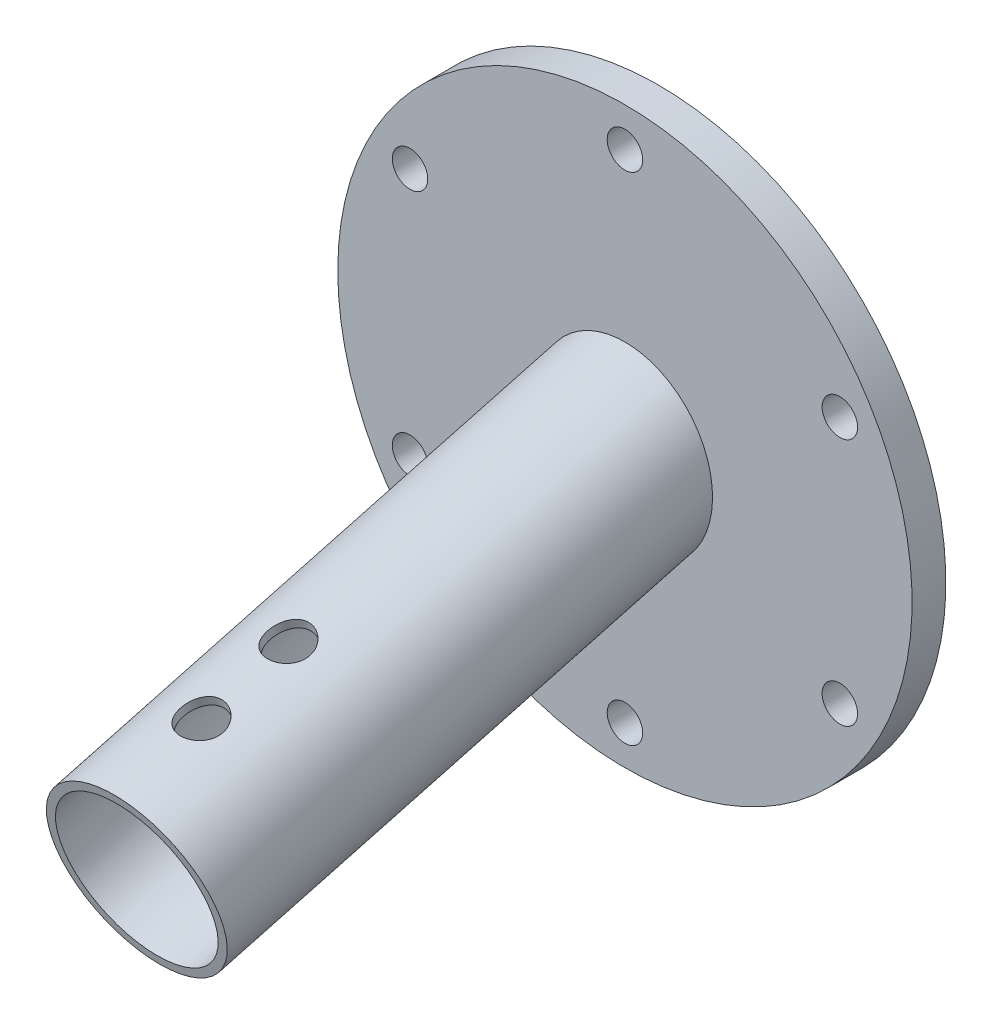
from build123d import *

# Parameters (mm, degrees)
SKETCH1_R               = 40.5
SKETCH1_R_2             = 2.5
BOSS_EXTRUDE1_DEPTH     = 4.7625
SWEEP_THIN1_PROFILE_R   = 12.3571
SWEEP_THIN1_PROFILE_R_2 = 11.1125
CUT_EXTRUDE2_DEPTH      = 96.807184511
CUT_EXTRUDE2_DEPTH_BACK = 96.807184511
SKETCH18_R              = 3


with BuildPart() as part:
    # Sketch1 → Boss-Extrude1 (new body)
    with BuildSketch(Plane.XY):
        with Locations(Location((0, 0, 0), (0, 0, 180))):
            Circle(SKETCH1_R)
        with Locations(Location((-30.310889132, -17.5, 0), (0, 0, 180))):
            Circle(SKETCH1_R_2, mode=Mode.SUBTRACT)
        with Locations(Location((0, -35, 0), (0, 0, 180))):
            Circle(SKETCH1_R_2, mode=Mode.SUBTRACT)
        with Locations(Location((30.310889132, -17.5, 0), (0, 0, 180))):
            Circle(SKETCH1_R_2, mode=Mode.SUBTRACT)
        with Locations(Location((30.310889132, 17.5, 0), (0, 0, 180))):
            Circle(SKETCH1_R_2, mode=Mode.SUBTRACT)
        with Locations(Location((0, 35, 0), (0, 0, 180))):
            Circle(SKETCH1_R_2, mode=Mode.SUBTRACT)
        with Locations(Location((-30.310889132, 17.5, 0), (0, 0, 180))):
            Circle(SKETCH1_R_2, mode=Mode.SUBTRACT)
    extrude(amount=BOSS_EXTRUDE1_DEPTH)

    # Sweep-Thin1: sweep along a path in Sketch6
    with BuildLine(Plane(origin=(0, 0, 0), x_dir=(0, 0, -1), z_dir=(1, 0, 0))) as sweep_thin1_path:
        Line((0, 0), (-73.603547963, -19.722011237))
    # Sweep-Thin1 profile (on start of the path) → Sweep-Thin1 (sweep)
    with BuildSketch(Plane(origin=(0, 0, 0), x_dir=(0, 0.965925826289069, 0.25881904510251813), z_dir=(0, -0.25881904510251813, 0.965925826289069))):
        Circle(SWEEP_THIN1_PROFILE_R)
        Circle(SWEEP_THIN1_PROFILE_R_2, mode=Mode.SUBTRACT)
    sweep(path=sweep_thin1_path.line)

    # Sketch18 → Cut-Extrude2 (cut, two sides: drawn at the far end of the back side and taken through both)
    with BuildSketch(Plane(origin=(0, 0, 0), x_dir=(-1, 0, 0), z_dir=(0, -0.9659258262890691, -0.25881904510251813)).offset(-CUT_EXTRUDE2_DEPTH_BACK)):
        with Locations(Location((0, -63.5, 0), (0, 0, 90))):
            Circle(SKETCH18_R)
        with Locations(Location((0, -50.8, 0), (0, 0, 90))):
            Circle(SKETCH18_R)
    extrude(amount=CUT_EXTRUDE2_DEPTH + CUT_EXTRUDE2_DEPTH_BACK, mode=Mode.SUBTRACT)


solid = part.part
